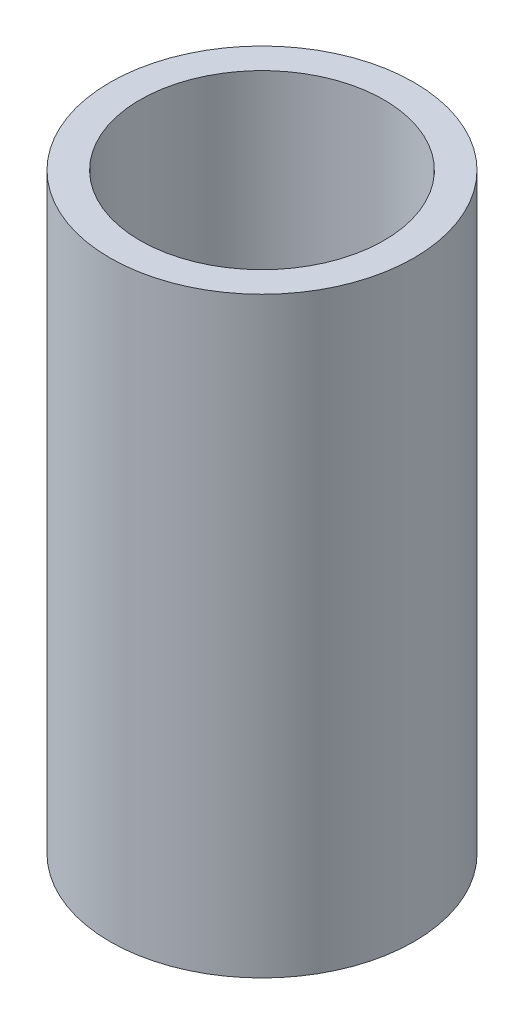
from build123d import *

# Parameters (mm, degrees)
SKETCH1_R           = 7.575
SKETCH1_R_2         = 6.075
BOSS_EXTRUDE1_DEPTH = 29.5


with BuildPart() as part:
    # Sketch1 → Boss-Extrude1 (new body)
    with BuildSketch(Plane(origin=(0, 0, 0), x_dir=(1, 0, 0), z_dir=(0, 1, 0))):
        with Locations(Location((0, 0, 0), (0, 0, 270))):
            Circle(SKETCH1_R)
        with Locations(Location((0, 0, 0), (0, 0, 270))):
            Circle(SKETCH1_R_2, mode=Mode.SUBTRACT)
    extrude(amount=BOSS_EXTRUDE1_DEPTH)


solid = part.part
